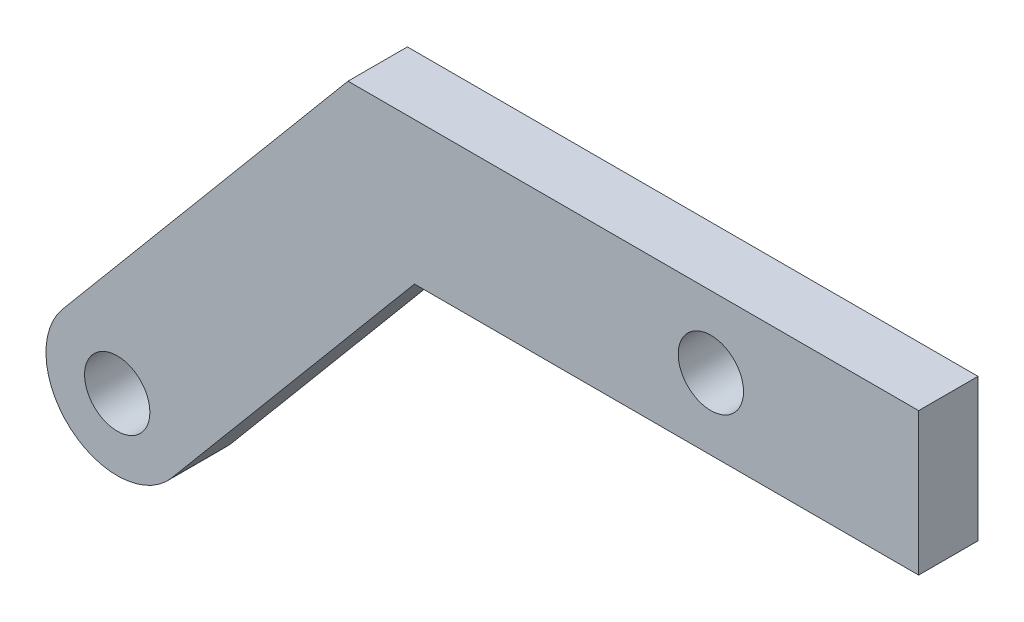
from build123d import *

# Parameters (mm, degrees)
SKETCH1_R           = 5.5
BOSS_EXTRUDE1_DEPTH = 10


with BuildPart() as part:
    # Sketch1 → Boss-Extrude1 (new body)
    with BuildSketch(Plane.XY):
        with BuildLine():
            Line((-9.192533317, 7.713451316), (38.876588555, 65))
            Line((38.876588555, 65), (135, 65))
            Line((135, 65), (135, 41))
            Line((135, 41), (50.06797235, 41))
            Line((50.06797235, 41), (9.192533317, -7.713451316))
            ThreePointArc((9.192533317, -7.713451316), (-7.713451316, -9.192533317), (-9.192533317, 7.713451316))
        make_face()
        Circle(SKETCH1_R, mode=Mode.SUBTRACT)
        with Locations((100, 53)):
            Circle(SKETCH1_R, mode=Mode.SUBTRACT)
    extrude(amount=BOSS_EXTRUDE1_DEPTH)


solid = part.part
